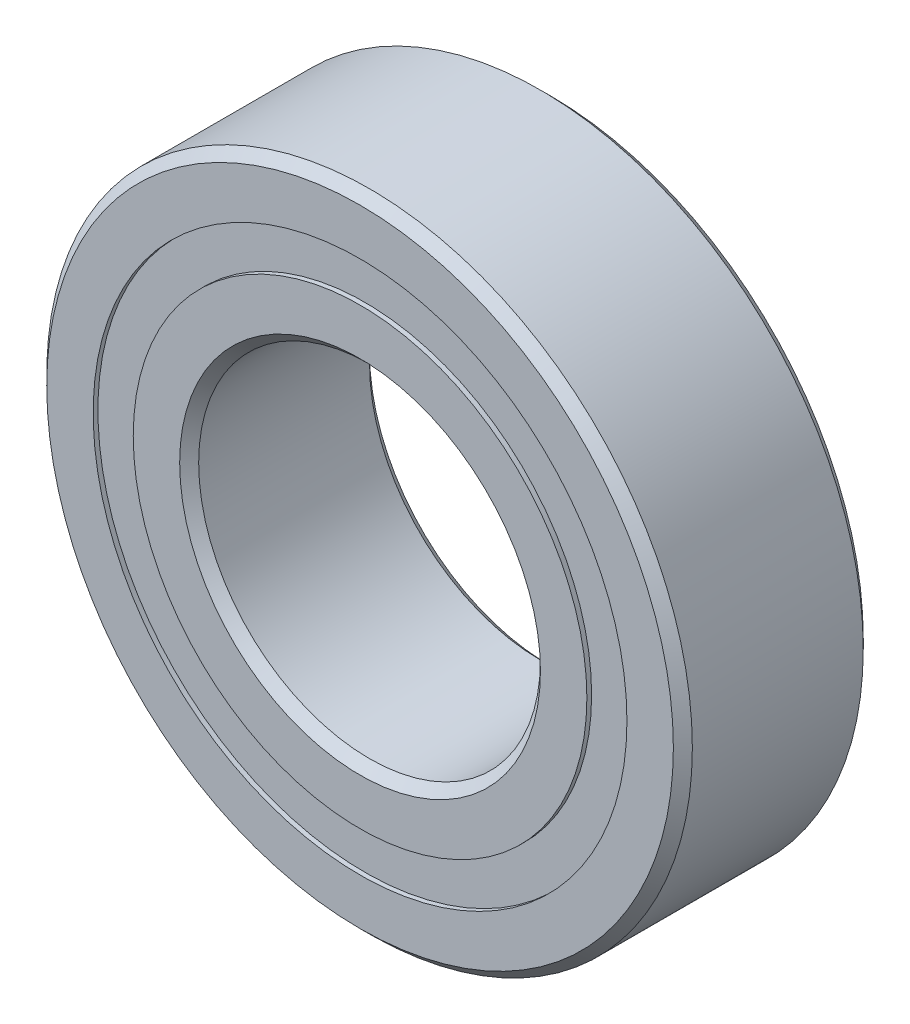
from build123d import *

# Parameters (mm, degrees)
CIRPATTERN1_COUNT = 12
SKETCH5_W         = 1.145042615
SKETCH5_H         = 1.054945054


with BuildPart() as part:
    # Sketch1 → Revolve1 (revolve)
    with BuildSketch(Plane(origin=(0, 0, 0), x_dir=(0, 0, -1), z_dir=(1, 0, 0)), mode=Mode.PRIVATE) as revolve1_sk:
        with BuildLine():
            Line((2.25, 8.5), (-2.25, 8.5))
            Line((-2.25, 8.5), (-2.5, 8.25))
            Line((-2.5, 8.25), (-2.5, 7.027472527))
            Line((-2.5, 7.027472527), (-1.111111111, 7.027472527))
            ThreePointArc((-1.111111111, 7.027472527), (0, 7.729957385), (1.111111111, 7.027472527))
            Line((1.111111111, 7.027472527), (2.5, 7.027472527))
            Line((2.5, 7.027472527), (2.5, 8.25))
            Line((2.5, 8.25), (2.25, 8.5))
        make_face()
    revolve(revolve1_sk.sketch.rotate(Axis((0, 0, 2.5), (0, 0, -1)), 90), axis=Axis((0, 0, 2.5), (0, 0, -1)))


with BuildPart() as body_2:
    # Sketch3 → Revolve3 (revolve)
    with BuildSketch(Plane(origin=(0, 0, 0), x_dir=(0, 0, -1), z_dir=(1, 0, 0)), mode=Mode.PRIVATE) as revolve3_sk:
        with BuildLine():
            Line((-2.5, 5.972527473), (-1.111111111, 5.972527473))
            ThreePointArc((-1.111111111, 5.972527473), (0, 5.270042615), (1.111111111, 5.972527473))
            Line((1.111111111, 5.972527473), (2.5, 5.972527473))
            Line((2.5, 5.972527473), (2.5, 4.75))
            Line((2.5, 4.75), (2.25, 4.5))
            Line((2.25, 4.5), (-2.25, 4.5))
            Line((-2.25, 4.5), (-2.5, 4.75))
            Line((-2.5, 4.75), (-2.5, 5.972527473))
        make_face()
    revolve(revolve3_sk.sketch.rotate(Axis((0, 0, 2.5), (0, 0, -1)), 90), axis=Axis((0, 0, 2.5), (0, 0, -1)))


with BuildPart() as body_3:
    # Sketch4 → Revolve4 (revolve)
    with BuildSketch(Plane(origin=(0, 0, 0), x_dir=(0, 0, -1), z_dir=(1, 0, 0))):
        with BuildLine():
            Line((-1.229957385, 6.5), (1.229957385, 6.5))
            ThreePointArc((1.229957385, 6.5), (0, 7.729957385), (-1.229957385, 6.5))
        make_face()
    revolve(axis=Axis((0, 6.5, 1.229957385), (0, 0, -1)))


with BuildPart() as cirpattern1_1:
    # CirPattern1: pattern copy
    add(body_3.part.rotate(Axis((0, 0, 0), (0, 0, 1)), 1 * 360 / CIRPATTERN1_COUNT))


with BuildPart() as cirpattern1_2:
    # CirPattern1: pattern copy
    add(body_3.part.rotate(Axis((0, 0, 0), (0, 0, 1)), 2 * 360 / CIRPATTERN1_COUNT))


with BuildPart() as cirpattern1_3:
    # CirPattern1: pattern copy
    add(body_3.part.rotate(Axis((0, 0, 0), (0, 0, 1)), 3 * 360 / CIRPATTERN1_COUNT))


with BuildPart() as cirpattern1_4:
    # CirPattern1: pattern copy
    add(body_3.part.rotate(Axis((0, 0, 0), (0, 0, 1)), 4 * 360 / CIRPATTERN1_COUNT))


with BuildPart() as cirpattern1_5:
    # CirPattern1: pattern copy
    add(body_3.part.rotate(Axis((0, 0, 0), (0, 0, 1)), 5 * 360 / CIRPATTERN1_COUNT))


with BuildPart() as cirpattern1_6:
    # CirPattern1: pattern copy
    add(body_3.part.rotate(Axis((0, 0, 0), (0, 0, 1)), 6 * 360 / CIRPATTERN1_COUNT))


with BuildPart() as cirpattern1_7:
    # CirPattern1: pattern copy
    add(body_3.part.rotate(Axis((0, 0, 0), (0, 0, 1)), 7 * 360 / CIRPATTERN1_COUNT))


with BuildPart() as cirpattern1_8:
    # CirPattern1: pattern copy
    add(body_3.part.rotate(Axis((0, 0, 0), (0, 0, 1)), 8 * 360 / CIRPATTERN1_COUNT))


with BuildPart() as cirpattern1_9:
    # CirPattern1: pattern copy
    add(body_3.part.rotate(Axis((0, 0, 0), (0, 0, 1)), 9 * 360 / CIRPATTERN1_COUNT))


with BuildPart() as cirpattern1_10:
    # CirPattern1: pattern copy
    add(body_3.part.rotate(Axis((0, 0, 0), (0, 0, 1)), 10 * 360 / CIRPATTERN1_COUNT))


with BuildPart() as cirpattern1_11:
    # CirPattern1: pattern copy
    add(body_3.part.rotate(Axis((0, 0, 0), (0, 0, 1)), 11 * 360 / CIRPATTERN1_COUNT))


with BuildPart() as body_15:
    # Sketch5 → Revolve5 (revolve)
    with BuildSketch(Plane(origin=(0, 0, 0), x_dir=(0, 0, -1), z_dir=(1, 0, 0)), mode=Mode.PRIVATE) as revolve5_sk:
        with Locations((-1.802478693, 6.5)):
            Rectangle(SKETCH5_W, SKETCH5_H)
        with Locations((1.802478693, 6.5)):
            Rectangle(SKETCH5_W, SKETCH5_H)
    revolve(revolve5_sk.sketch.rotate(Axis((0, 0, 2.5), (0, 0, -1)), 90), axis=Axis((0, 0, 2.5), (0, 0, -1)))


solid = Compound([part.part, body_2.part, body_3.part, cirpattern1_1.part, cirpattern1_2.part, cirpattern1_3.part, cirpattern1_4.part, cirpattern1_5.part, cirpattern1_6.part, cirpattern1_7.part, cirpattern1_8.part, cirpattern1_9.part, cirpattern1_10.part, cirpattern1_11.part, body_15.part])
